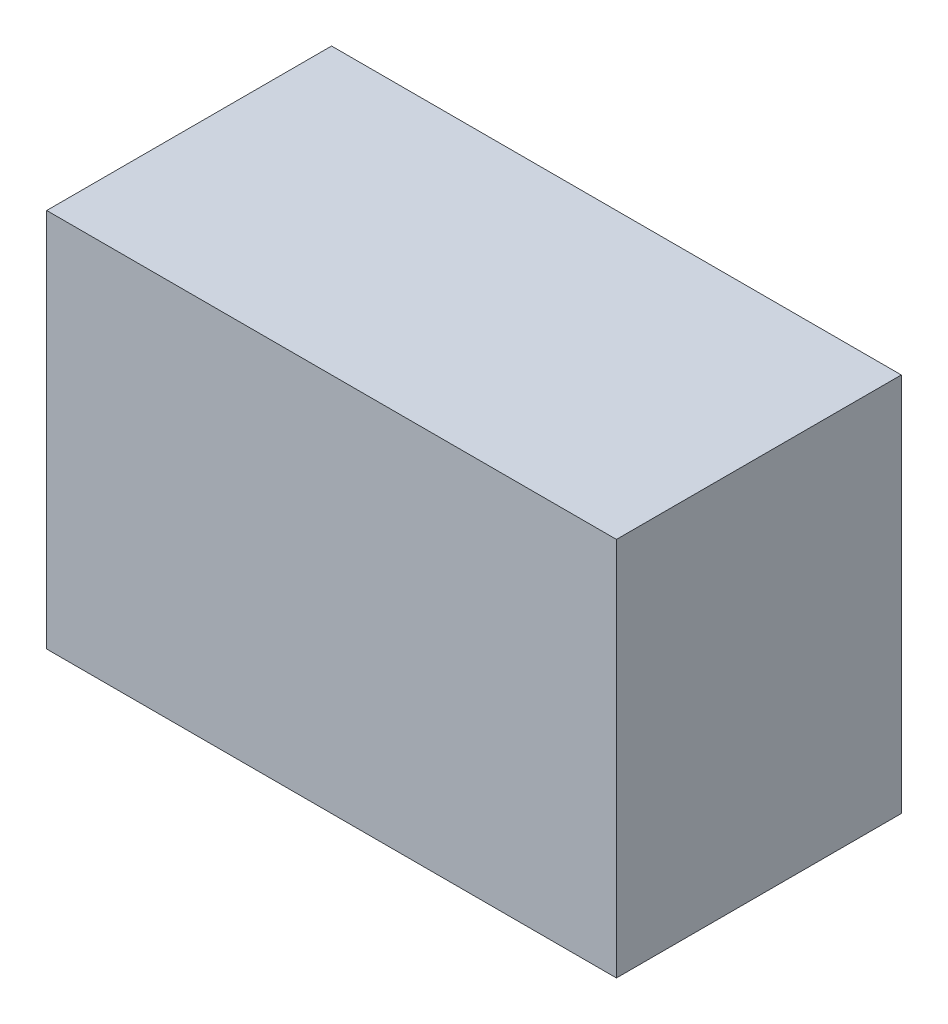
from build123d import *

# Parameters (mm, degrees)
ESQUISSE1_W          = 30
ESQUISSE1_H          = 20
BASE_EXTRUSION_DEPTH = 15


with BuildPart() as part:
    # Esquisse1 → Base-Extrusion (new body)
    with BuildSketch(Plane.XY):
        with Locations((15, 10)):
            Rectangle(ESQUISSE1_W, ESQUISSE1_H)
    extrude(amount=BASE_EXTRUSION_DEPTH)


solid = part.part
